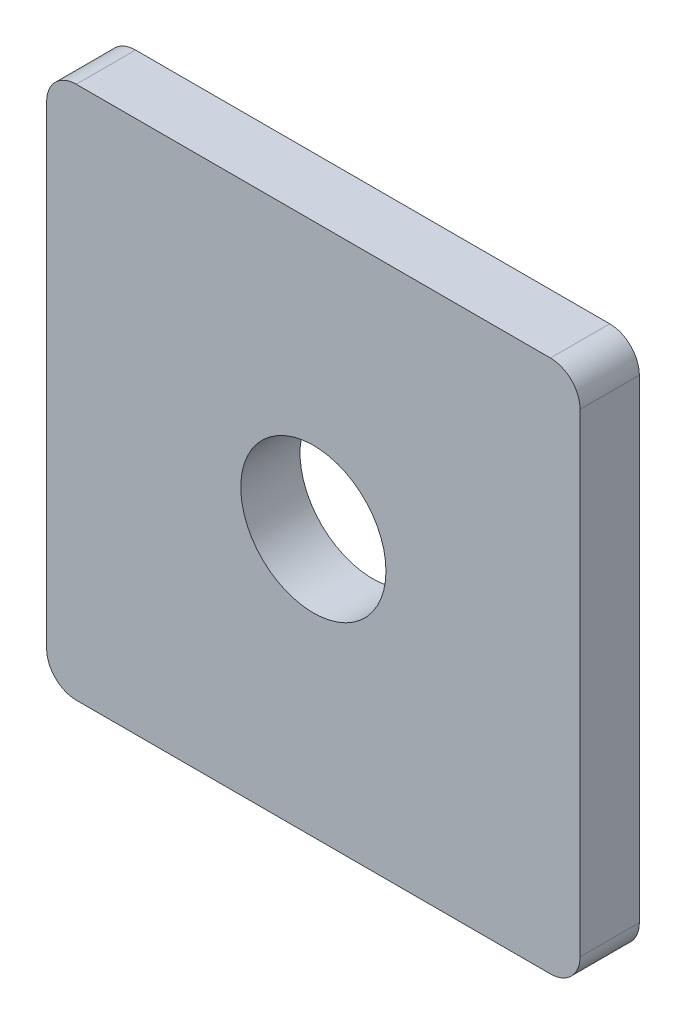
from build123d import *

# Parameters (mm, degrees)
SKETCH1_W           = 18
SKETCH1_H           = 18
SKETCH1_R           = 2.45
BOSS_EXTRUDE1_DEPTH = 2
FILLET1_R           = 1


with BuildPart() as part:
    # Sketch1 → Boss-Extrude1 (new body)
    with BuildSketch(Plane.XY):
        Rectangle(SKETCH1_W, SKETCH1_H)
        Circle(SKETCH1_R, mode=Mode.SUBTRACT)
    extrude(amount=BOSS_EXTRUDE1_DEPTH)

    # Fillet1
    fillet1_edges = [part.edges().sort_by_distance(p)[0] for p in [
        (9, -9, 1),
        (-9, -9, 1),
        (-9, 9, 1),
        (9, 9, 1),
    ]]
    fillet(fillet1_edges, radius=FILLET1_R)


solid = part.part
